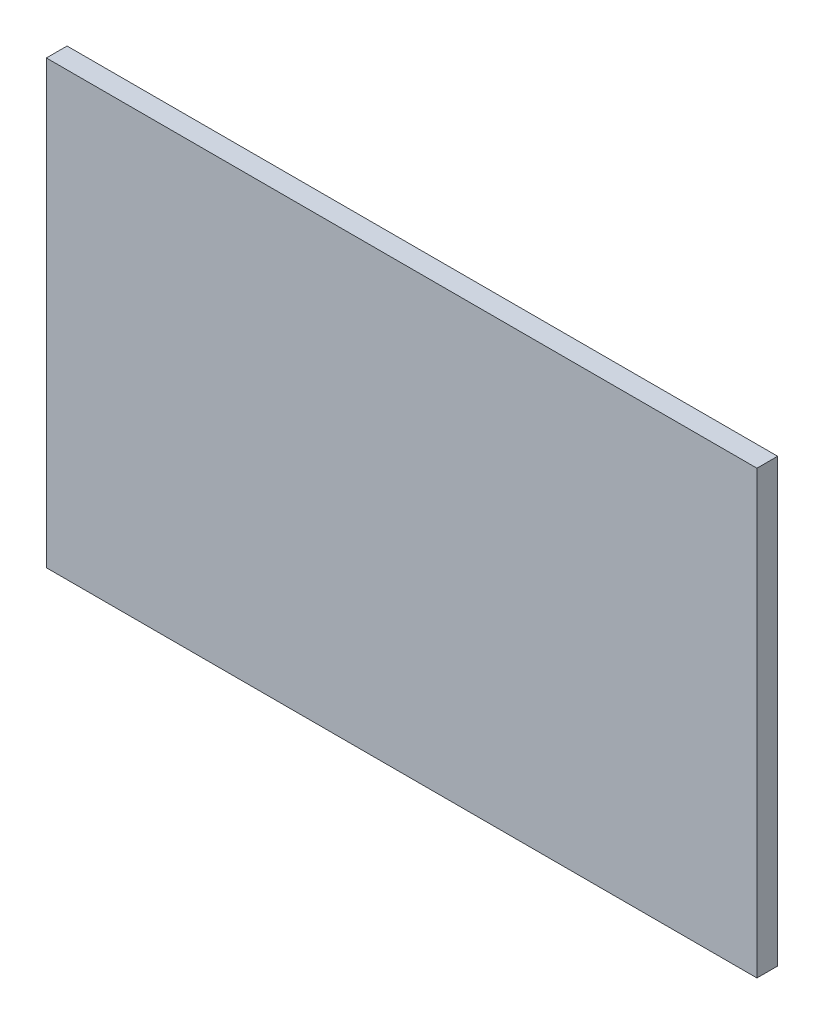
from build123d import *

# Parameters (mm, degrees)
SKETCH1_W           = 103
SKETCH1_H           = 64
BOSS_EXTRUDE1_DEPTH = 3


with BuildPart() as part:
    # Sketch1 → Boss-Extrude1 (new body)
    with BuildSketch(Plane.XY):
        Rectangle(SKETCH1_W, SKETCH1_H)
    extrude(amount=BOSS_EXTRUDE1_DEPTH)


solid = part.part
